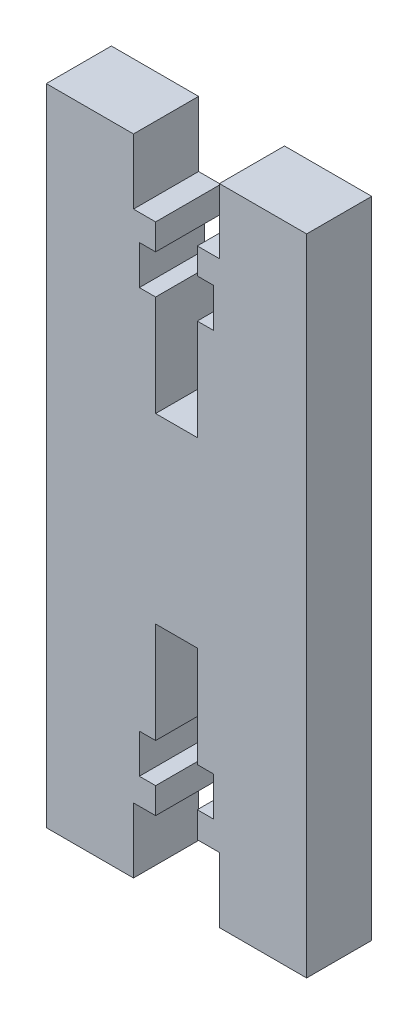
from build123d import *

# Parameters (mm, degrees)
BOSS_EXTRU_1_DEPTH = 5


with BuildPart() as part:
    # Esquisse1 → Boss.-Extru.1 (new body)
    with BuildSketch(Plane.XY):
        Polygon((-12.911051911, 41.325067336), (-12.911051911, -8.174932664), (-6.211051911, -8.174932664), (-6.211051911, -3.174932664), (-4.511051911, -3.174932664), (-4.511051911, -1.178236629), (-5.761051911, -1.178236629), (-5.761051911, 1.821763371), (-4.511051911, 1.821763371), (-4.511051911, 9.575067336), (-1.311051911, 9.575067336), (-1.311051911, 1.821763371), (-0.061051911, 1.821763371), (-0.061051911, -1.178236629), (-1.311051911, -1.178236629), (-1.311051911, -3.174932664), (0.388948089, -3.174932664), (0.388948089, -8.174932664), (7.088948089, -8.174932664), (7.088948089, 41.325067336), (0.388948089, 41.325067336), (0.388948089, 36.325067336), (-1.311051911, 36.325067336), (-1.311051911, 34.328371301), (-0.061051911, 34.328371301), (-0.061051911, 31.328371301), (-1.311051911, 31.328371301), (-1.311051911, 23.575067336), (-4.511051911, 23.575067336), (-4.511051911, 31.328371301), (-5.761051911, 31.328371301), (-5.761051911, 34.328371301), (-4.511051911, 34.328371301), (-4.511051911, 36.325067336), (-6.211051911, 36.325067336), (-6.211051911, 41.325067336), align=None)
    extrude(amount=BOSS_EXTRU_1_DEPTH)


solid = part.part
